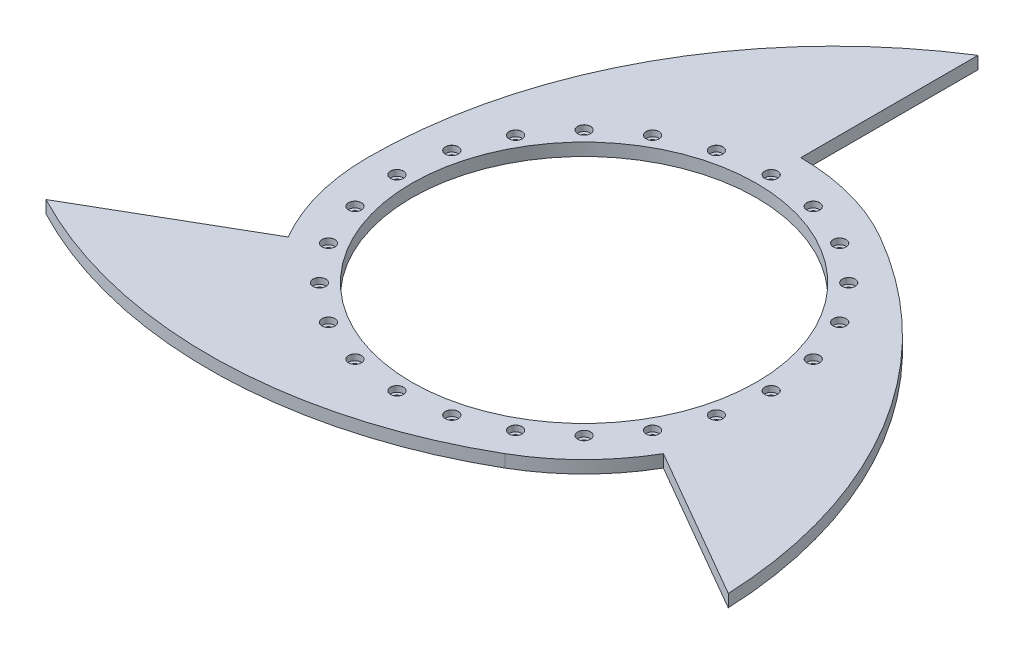
from build123d import *

# Parameters (mm, degrees)
SKETCH1_R                      = 87.5
BOSS_EXTRUDE1_DEPTH            = 6.35
CBORE_FOR_M3_SHCS1_AT_2_COUNT  = 2
CBORE_FOR_M3_SHCS1_AT_2_PITCH  = 24.799976522
CBORE_FOR_M3_SHCS1_AT_3_COUNT  = 2
CBORE_FOR_M3_SHCS1_AT_3_PITCH  = 49.175618569
CBORE_FOR_M3_SHCS1_AT_4_COUNT  = 2
CBORE_FOR_M3_SHCS1_AT_4_PITCH  = 72.709852149
CBORE_FOR_M3_SHCS1_AT_5_COUNT  = 2
CBORE_FOR_M3_SHCS1_AT_5_PITCH  = 95
CBORE_FOR_M3_SHCS1_AT_6_COUNT  = 2
CBORE_FOR_M3_SHCS1_AT_6_PITCH  = 115.664671512
CBORE_FOR_M3_SHCS1_AT_7_COUNT  = 2
CBORE_FOR_M3_SHCS1_AT_7_PITCH  = 134.350288425
CBORE_FOR_M3_SHCS1_AT_8_COUNT  = 2
CBORE_FOR_M3_SHCS1_AT_8_PITCH  = 150.737134655
CBORE_FOR_M3_SHCS1_AT_9_COUNT  = 2
CBORE_FOR_M3_SHCS1_AT_9_PITCH  = 164.544826719
CBORE_FOR_M3_SHCS1_AT_10_COUNT = 2
CBORE_FOR_M3_SHCS1_AT_10_PITCH = 175.537111177
CBORE_FOR_M3_SHCS1_AT_11_COUNT = 2
CBORE_FOR_M3_SHCS1_AT_11_PITCH = 183.525906995
CBORE_FOR_M3_SHCS1_AT_12_COUNT = 2
CBORE_FOR_M3_SHCS1_AT_12_PITCH = 188.374523661
CBORE_FOR_M3_SHCS1_AT_13_COUNT = 2
CBORE_FOR_M3_SHCS1_AT_13_PITCH = 190
CBORE_FOR_M3_SHCS1_AT_14_COUNT = 2
CBORE_FOR_M3_SHCS1_AT_14_PITCH = 188.374523661
CBORE_FOR_M3_SHCS1_AT_15_COUNT = 2
CBORE_FOR_M3_SHCS1_AT_15_PITCH = 183.525906995
CBORE_FOR_M3_SHCS1_AT_16_COUNT = 2
CBORE_FOR_M3_SHCS1_AT_16_PITCH = 175.537111177
CBORE_FOR_M3_SHCS1_AT_17_COUNT = 2
CBORE_FOR_M3_SHCS1_AT_17_PITCH = 164.544826719
CBORE_FOR_M3_SHCS1_AT_18_COUNT = 2
CBORE_FOR_M3_SHCS1_AT_18_PITCH = 150.737134655
CBORE_FOR_M3_SHCS1_AT_19_COUNT = 2
CBORE_FOR_M3_SHCS1_AT_19_PITCH = 134.350288425
CBORE_FOR_M3_SHCS1_AT_20_COUNT = 2
CBORE_FOR_M3_SHCS1_AT_20_PITCH = 115.664671512
CBORE_FOR_M3_SHCS1_AT_21_COUNT = 2
CBORE_FOR_M3_SHCS1_AT_21_PITCH = 95
CBORE_FOR_M3_SHCS1_AT_22_COUNT = 2
CBORE_FOR_M3_SHCS1_AT_22_PITCH = 72.709852149
CBORE_FOR_M3_SHCS1_AT_23_COUNT = 2
CBORE_FOR_M3_SHCS1_AT_23_PITCH = 49.175618569
CBORE_FOR_M3_SHCS1_AT_24_COUNT = 2
CBORE_FOR_M3_SHCS1_AT_24_PITCH = 24.799976522
CBORE_FOR_M3_SHCS1_AT_25_COUNT = 2
CBORE_FOR_M3_SHCS1_AT_25_PITCH = 95


with BuildPart() as part:
    # Sketch1 → Boss-Extrude1 (new body)
    with BuildSketch(Plane(origin=(0, 0, 0), x_dir=(1, 0, 0), z_dir=(0, 1, 0))):
        with BuildLine():
            Line((0, 200), (0, 110))
            ThreePointArc((0, 110), (28.470094961, 106.251840892), (55, 95.262794416))
            ThreePointArc((55, 95.262794416), (139.179825281, 12.812284565), (173.205080757, -100))
            Line((173.205080757, -100), (95.262794416, -55))
            ThreePointArc((95.262794416, -55), (77.781745931, -77.781745931), (55, -95.262794416))
            ThreePointArc((55, -95.262794416), (-58.494148726, -126.939406671), (-173.205080757, -100))
            Line((-173.205080757, -100), (-95.262794416, -55))
            ThreePointArc((-95.262794416, -55), (-106.251840892, -28.470094961), (-110, 0))
            ThreePointArc((-110, 0), (-80.685676555, 114.127122105), (0, 200))
        make_face()
        with Locations(Location((0, 0, 0), (0, 0, 270))):
            Circle(SKETCH1_R, mode=Mode.SUBTRACT)
    extrude(amount=BOSS_EXTRUDE1_DEPTH)

    # Sketch3 → CBORE for M3 SHCS1 (revolve, cut)
    with BuildSketch(Plane(origin=(95, 6.35, 0), x_dir=(0, 0, 1), z_dir=(1, 0, 0))):
        Polygon((0, 0), (0, 6.35), (1.6, 6.35), (1.6, 3), (3.25, 3), (3.25, 0.025), (3.275, 0), align=None)
    cbore_for_m3_shcs1 = revolve(axis=Axis((95, 12.7, 0), (0, -1, 0)), mode=Mode.SUBTRACT)

    # CBORE for M3 SHCS1 at 2: CBORE for M3 SHCS1 ×2
    with Locations(*[Vector(-0.1305261922200521, 0, 0.9914448613738104) * (i * CBORE_FOR_M3_SHCS1_AT_2_PITCH) for i in range(1, CBORE_FOR_M3_SHCS1_AT_2_COUNT)]):
        add(cbore_for_m3_shcs1, mode=Mode.SUBTRACT)

    # CBORE for M3 SHCS1 at 3: CBORE for M3 SHCS1 ×2
    with Locations(*[Vector(-0.2588190451025218, 0, 0.965925826289068) * (i * CBORE_FOR_M3_SHCS1_AT_3_PITCH) for i in range(1, CBORE_FOR_M3_SHCS1_AT_3_COUNT)]):
        add(cbore_for_m3_shcs1, mode=Mode.SUBTRACT)

    # CBORE for M3 SHCS1 at 4: CBORE for M3 SHCS1 ×2
    with Locations(*[Vector(-0.38268343236509056, 0, 0.9238795325112865) * (i * CBORE_FOR_M3_SHCS1_AT_4_PITCH) for i in range(1, CBORE_FOR_M3_SHCS1_AT_4_COUNT)]):
        add(cbore_for_m3_shcs1, mode=Mode.SUBTRACT)

    # CBORE for M3 SHCS1 at 5: CBORE for M3 SHCS1 ×2
    with Locations(*[Vector(-0.5000000000000009, 0, 0.8660254037844382) * (i * CBORE_FOR_M3_SHCS1_AT_5_PITCH) for i in range(1, CBORE_FOR_M3_SHCS1_AT_5_COUNT)]):
        add(cbore_for_m3_shcs1, mode=Mode.SUBTRACT)

    # CBORE for M3 SHCS1 at 6: CBORE for M3 SHCS1 ×2
    with Locations(*[Vector(-0.6087614290087218, 0, 0.7933533402912344) * (i * CBORE_FOR_M3_SHCS1_AT_6_PITCH) for i in range(1, CBORE_FOR_M3_SHCS1_AT_6_COUNT)]):
        add(cbore_for_m3_shcs1, mode=Mode.SUBTRACT)

    # CBORE for M3 SHCS1 at 7: CBORE for M3 SHCS1 ×2
    with Locations(*[Vector(-0.7071067811865487, 0, 0.7071067811865464) * (i * CBORE_FOR_M3_SHCS1_AT_7_PITCH) for i in range(1, CBORE_FOR_M3_SHCS1_AT_7_COUNT)]):
        add(cbore_for_m3_shcs1, mode=Mode.SUBTRACT)

    # CBORE for M3 SHCS1 at 8: CBORE for M3 SHCS1 ×2
    with Locations(*[Vector(-0.7933533402912363, 0, 0.6087614290087191) * (i * CBORE_FOR_M3_SHCS1_AT_8_PITCH) for i in range(1, CBORE_FOR_M3_SHCS1_AT_8_COUNT)]):
        add(cbore_for_m3_shcs1, mode=Mode.SUBTRACT)

    # CBORE for M3 SHCS1 at 9: CBORE for M3 SHCS1 ×2
    with Locations(*[Vector(-0.8660254037844398, 0, 0.499999999999998) * (i * CBORE_FOR_M3_SHCS1_AT_9_PITCH) for i in range(1, CBORE_FOR_M3_SHCS1_AT_9_COUNT)]):
        add(cbore_for_m3_shcs1, mode=Mode.SUBTRACT)

    # CBORE for M3 SHCS1 at 10: CBORE for M3 SHCS1 ×2
    with Locations(*[Vector(-0.9238795325112878, 0, 0.3826834323650874) * (i * CBORE_FOR_M3_SHCS1_AT_10_PITCH) for i in range(1, CBORE_FOR_M3_SHCS1_AT_10_COUNT)]):
        add(cbore_for_m3_shcs1, mode=Mode.SUBTRACT)

    # CBORE for M3 SHCS1 at 11: CBORE for M3 SHCS1 ×2
    with Locations(*[Vector(-0.9659258262890691, 0, 0.25881904510251796) * (i * CBORE_FOR_M3_SHCS1_AT_11_PITCH) for i in range(1, CBORE_FOR_M3_SHCS1_AT_11_COUNT)]):
        add(cbore_for_m3_shcs1, mode=Mode.SUBTRACT)

    # CBORE for M3 SHCS1 at 12: CBORE for M3 SHCS1 ×2
    with Locations(*[Vector(-0.9914448613738108, 0, 0.13052619222004846) * (i * CBORE_FOR_M3_SHCS1_AT_12_PITCH) for i in range(1, CBORE_FOR_M3_SHCS1_AT_12_COUNT)]):
        add(cbore_for_m3_shcs1, mode=Mode.SUBTRACT)

    # CBORE for M3 SHCS1 at 13: CBORE for M3 SHCS1 ×2
    with Locations(*[(-i * CBORE_FOR_M3_SHCS1_AT_13_PITCH, 0, 0) for i in range(1, CBORE_FOR_M3_SHCS1_AT_13_COUNT)]):
        add(cbore_for_m3_shcs1, mode=Mode.SUBTRACT)

    # CBORE for M3 SHCS1 at 14: CBORE for M3 SHCS1 ×2
    with Locations(*[Vector(-0.9914448613738099, 0, -0.13052619222005532) * (i * CBORE_FOR_M3_SHCS1_AT_14_PITCH) for i in range(1, CBORE_FOR_M3_SHCS1_AT_14_COUNT)]):
        add(cbore_for_m3_shcs1, mode=Mode.SUBTRACT)

    # CBORE for M3 SHCS1 at 15: CBORE for M3 SHCS1 ×2
    with Locations(*[Vector(-0.9659258262890673, 0, -0.25881904510252474) * (i * CBORE_FOR_M3_SHCS1_AT_15_PITCH) for i in range(1, CBORE_FOR_M3_SHCS1_AT_15_COUNT)]):
        add(cbore_for_m3_shcs1, mode=Mode.SUBTRACT)

    # CBORE for M3 SHCS1 at 16: CBORE for M3 SHCS1 ×2
    with Locations(*[Vector(-0.9238795325112852, 0, -0.38268343236509383) * (i * CBORE_FOR_M3_SHCS1_AT_16_PITCH) for i in range(1, CBORE_FOR_M3_SHCS1_AT_16_COUNT)]):
        add(cbore_for_m3_shcs1, mode=Mode.SUBTRACT)

    # CBORE for M3 SHCS1 at 17: CBORE for M3 SHCS1 ×2
    with Locations(*[Vector(-0.8660254037844364, 0, -0.5000000000000039) * (i * CBORE_FOR_M3_SHCS1_AT_17_PITCH) for i in range(1, CBORE_FOR_M3_SHCS1_AT_17_COUNT)]):
        add(cbore_for_m3_shcs1, mode=Mode.SUBTRACT)

    # CBORE for M3 SHCS1 at 18: CBORE for M3 SHCS1 ×2
    with Locations(*[Vector(-0.7933533402912322, 0, -0.6087614290087247) * (i * CBORE_FOR_M3_SHCS1_AT_18_PITCH) for i in range(1, CBORE_FOR_M3_SHCS1_AT_18_COUNT)]):
        add(cbore_for_m3_shcs1, mode=Mode.SUBTRACT)

    # CBORE for M3 SHCS1 at 19: CBORE for M3 SHCS1 ×2
    with Locations(*[Vector(-0.7071067811865438, 0, -0.7071067811865513) * (i * CBORE_FOR_M3_SHCS1_AT_19_PITCH) for i in range(1, CBORE_FOR_M3_SHCS1_AT_19_COUNT)]):
        add(cbore_for_m3_shcs1, mode=Mode.SUBTRACT)

    # CBORE for M3 SHCS1 at 20: CBORE for M3 SHCS1 ×2
    with Locations(*[Vector(-0.6087614290087162, 0, -0.7933533402912386) * (i * CBORE_FOR_M3_SHCS1_AT_20_PITCH) for i in range(1, CBORE_FOR_M3_SHCS1_AT_20_COUNT)]):
        add(cbore_for_m3_shcs1, mode=Mode.SUBTRACT)

    # CBORE for M3 SHCS1 at 21: CBORE for M3 SHCS1 ×2
    with Locations(*[Vector(-0.4999999999999949, 0, -0.8660254037844416) * (i * CBORE_FOR_M3_SHCS1_AT_21_PITCH) for i in range(1, CBORE_FOR_M3_SHCS1_AT_21_COUNT)]):
        add(cbore_for_m3_shcs1, mode=Mode.SUBTRACT)

    # CBORE for M3 SHCS1 at 22: CBORE for M3 SHCS1 ×2
    with Locations(*[Vector(-0.3826834323650841, 0, -0.9238795325112891) * (i * CBORE_FOR_M3_SHCS1_AT_22_PITCH) for i in range(1, CBORE_FOR_M3_SHCS1_AT_22_COUNT)]):
        add(cbore_for_m3_shcs1, mode=Mode.SUBTRACT)

    # CBORE for M3 SHCS1 at 23: CBORE for M3 SHCS1 ×2
    with Locations(*[Vector(-0.25881904510251497, 0, -0.9659258262890699) * (i * CBORE_FOR_M3_SHCS1_AT_23_PITCH) for i in range(1, CBORE_FOR_M3_SHCS1_AT_23_COUNT)]):
        add(cbore_for_m3_shcs1, mode=Mode.SUBTRACT)

    # CBORE for M3 SHCS1 at 24: CBORE for M3 SHCS1 ×2
    with Locations(*[Vector(-0.1305261922200453, 0, -0.9914448613738113) * (i * CBORE_FOR_M3_SHCS1_AT_24_PITCH) for i in range(1, CBORE_FOR_M3_SHCS1_AT_24_COUNT)]):
        add(cbore_for_m3_shcs1, mode=Mode.SUBTRACT)

    # CBORE for M3 SHCS1 at 25: CBORE for M3 SHCS1 ×2
    with Locations(*[(-i * CBORE_FOR_M3_SHCS1_AT_25_PITCH, 0, 0) for i in range(1, CBORE_FOR_M3_SHCS1_AT_25_COUNT)]):
        add(cbore_for_m3_shcs1, mode=Mode.SUBTRACT)


solid = part.part
